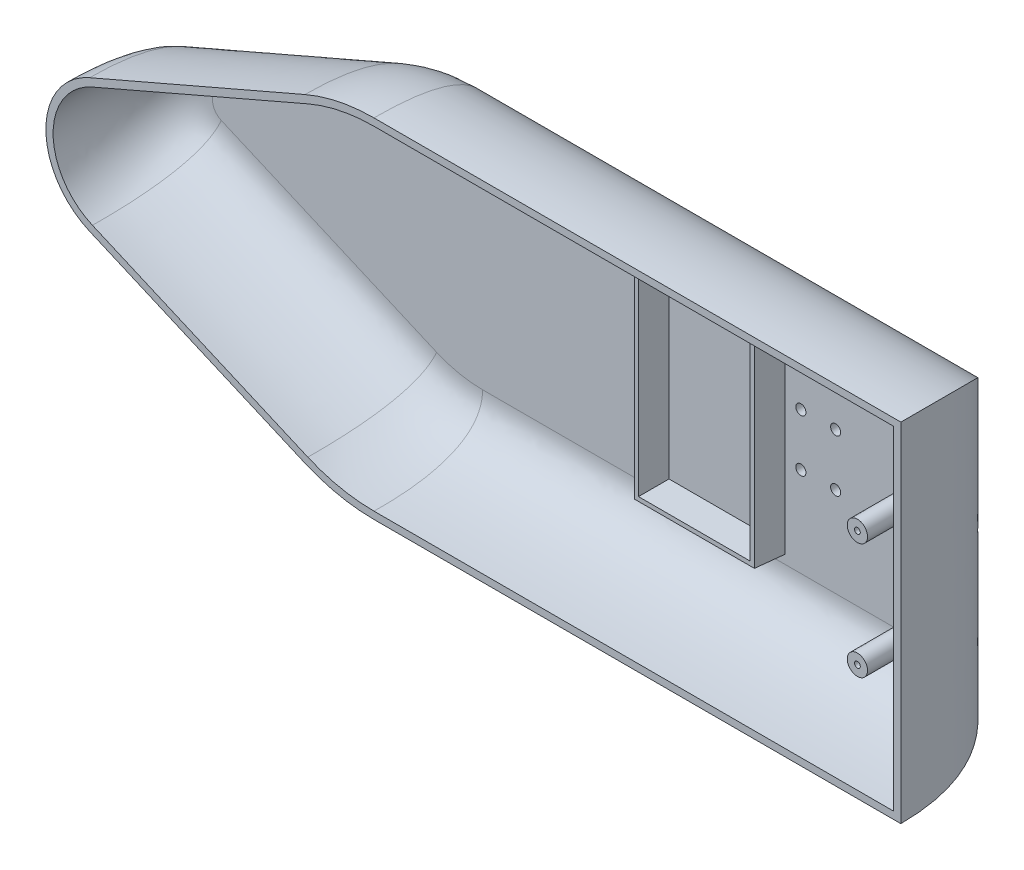
from build123d import *

# Parameters (mm, degrees)
BOSS_EXTRU_1_DEPTH           = 2.5
ENL_V_MAT_EXTRU_1_REACH      = 169.131
ESQUISSE3_R                  = 1.75
BOSS_EXTRU_2_DEPTH           = 10
BOSS_EXTRU_2_DRAFT           = -3
ESQUISSE4_W                  = 32.5
ESQUISSE4_H                  = 2.5
BOSS_EXTRU_2_PROFILE_2_DEPTH = 10
BOSS_EXTRU_2_PROFILE_2_DRAFT = -3
ENL_V_MAT_EXTRU_2_REACH      = 200.265
ESQUISSE8_R                  = 1
BOSS_EXTRU_3_REACH           = 200.265
ESQUISSE9_R                  = 3.5
ESQUISSE9_R_2                = 1


with BuildPart() as part:
    # Esquisse1 → Boss.-Extru.1 (new body)
    with BuildSketch(Plane.XY):
        with BuildLine():
            Line((149.100058284, 75.46875), (-12.711143092, 75.46875))
            ThreePointArc((-12.711143092, 75.46875), (-20.816828901, 74.638864342), (-28.58617509, 72.183642878))
            Line((-28.58617509, 72.183642878), (-102.884320715, 40.05811161))
            ThreePointArc((-102.884320715, 40.05811161), (-105.899941716, 35.46875), (-102.884320715, 30.87938839))
            Line((-102.884320715, 30.87938839), (-28.58617509, -1.246142878))
            ThreePointArc((-28.58617509, -1.246142878), (-20.816828901, -3.701364342), (-12.711143092, -4.53125))
            Line((-12.711143092, -4.53125), (149.100058284, -4.53125))
            Line((149.100058284, -4.53125), (149.100058284, 75.46875))
        make_face()
    extrude(amount=BOSS_EXTRU_1_DEPTH)

    # Esquisse3 → Enlèv. mat.-Extru.1 (cut, up to next)
    with BuildSketch(Plane.XY.offset(2.5), mode=Mode.PRIVATE) as enl_v_mat_extru_1_sk1:
        with Locations((97.100058284, 44.46875)):
            Circle(ESQUISSE3_R)
    enl_v_mat_extru_1_tool1 = extrude(enl_v_mat_extru_1_sk1.sketch, amount=-ENL_V_MAT_EXTRU_1_REACH, mode=Mode.PRIVATE) & part.part
    # Esquisse3 → Enlèv. mat.-Extru.1 (cut, up to next)
    with BuildSketch(Plane.XY.offset(2.5), mode=Mode.PRIVATE) as enl_v_mat_extru_1_sk2:
        with Locations((97.100058284, 26.46875)):
            Circle(ESQUISSE3_R)
    enl_v_mat_extru_1_tool2 = extrude(enl_v_mat_extru_1_sk2.sketch, amount=-ENL_V_MAT_EXTRU_1_REACH, mode=Mode.PRIVATE) & part.part
    # Esquisse3 → Enlèv. mat.-Extru.1 (cut, up to next)
    with BuildSketch(Plane.XY.offset(2.5), mode=Mode.PRIVATE) as enl_v_mat_extru_1_sk3:
        with Locations((109.100058284, 26.46875)):
            Circle(ESQUISSE3_R)
    enl_v_mat_extru_1_tool3 = extrude(enl_v_mat_extru_1_sk3.sketch, amount=-ENL_V_MAT_EXTRU_1_REACH, mode=Mode.PRIVATE) & part.part
    # Esquisse3 → Enlèv. mat.-Extru.1 (cut, up to next)
    with BuildSketch(Plane.XY.offset(2.5), mode=Mode.PRIVATE) as enl_v_mat_extru_1_sk4:
        with Locations((109.100058284, 44.46875)):
            Circle(ESQUISSE3_R)
    enl_v_mat_extru_1_tool4 = extrude(enl_v_mat_extru_1_sk4.sketch, amount=-ENL_V_MAT_EXTRU_1_REACH, mode=Mode.PRIVATE) & part.part
    add(enl_v_mat_extru_1_tool1.solids().sort_by_distance((97.100058, 44.46875, 2.5))[0], mode=Mode.SUBTRACT)
    add(enl_v_mat_extru_1_tool2.solids().sort_by_distance((97.100058, 26.46875, 2.5))[0], mode=Mode.SUBTRACT)
    add(enl_v_mat_extru_1_tool3.solids().sort_by_distance((109.100058, 26.46875, 2.5))[0], mode=Mode.SUBTRACT)
    add(enl_v_mat_extru_1_tool4.solids().sort_by_distance((109.100058, 44.46875, 2.5))[0], mode=Mode.SUBTRACT)


with BuildPart() as boss_extru_2_tool:
    # Esquisse4 → Boss.-Extru.2 (with draft: the straight prism first)
    with BuildSketch(Plane(origin=(0, 0, 2.5), x_dir=(-1, 0, 0), z_dir=(0, 0, -1))):
        Polygon((-51.600058284, 0.96875), (-89.100058284, 0.96875), (-89.100058284, 67.46875), (-91.600058284, 67.46875), (-91.600058284, -1.53125), (-49.100058284, -1.53125), (-49.100058284, 67.46875), (-51.600058284, 67.46875), align=None)
    extrude(amount=-BOSS_EXTRU_2_DEPTH)
    # Boss.-Extru.2: the draft: its side faces are tilted about the plane it starts from
    boss_extru_2_sides = [boss_extru_2_tool.faces().sort_by_distance(p)[0] for p in [
        (70.350058284, 0.96875, 7.5),
        (89.100058284, 34.21875, 7.5),
        (90.350058284, 67.46875, 7.5),
        (91.600058284, 32.96875, 7.5),
        (70.350058284, -1.53125, 7.5),
        (49.100058284, 32.96875, 7.5),
        (50.350058284, 67.46875, 7.5),
        (51.600058284, 34.21875, 7.5),
    ]]
    draft(boss_extru_2_sides, Plane(origin=(0, 0, 2.5), x_dir=(-1, 0, 0), z_dir=(0, 0, -1)), BOSS_EXTRU_2_DRAFT)


with BuildPart() as part_1:
    add(part.part)

    # Boss.-Extru.2: add boss_extru_2_tool
    add(boss_extru_2_tool.part)


with BuildPart() as boss_extru_2_profile_2_tool:
    # Esquisse4 → Boss.-Extru.2 profile 2 (with draft: the straight prism first)
    with BuildSketch(Plane(origin=(0, 0, 2.5), x_dir=(-1, 0, 0), z_dir=(0, 0, -1))):
        with Locations((-70.350058284, 71.21875)):
            Rectangle(ESQUISSE4_W, ESQUISSE4_H)
    extrude(amount=-BOSS_EXTRU_2_PROFILE_2_DEPTH)
    # Boss.-Extru.2 profile 2: the draft: its side faces are tilted about the plane it starts from
    boss_extru_2_profile_2_sides = [boss_extru_2_profile_2_tool.faces().sort_by_distance(p)[0] for p in [
        (54.100058284, 71.21875, 7.5),
        (70.350058284, 72.46875, 7.5),
        (86.600058284, 71.21875, 7.5),
        (70.350058284, 69.96875, 7.5),
    ]]
    draft(boss_extru_2_profile_2_sides, Plane(origin=(0, 0, 2.5), x_dir=(-1, 0, 0), z_dir=(0, 0, -1)), BOSS_EXTRU_2_PROFILE_2_DRAFT)


with BuildPart() as part_2:
    add(part_1.part)

    # Boss.-Extru.2 profile 2: add boss_extru_2_profile_2_tool
    add(boss_extru_2_profile_2_tool.part)

    # Balayage1: sweep along a path in Esquisse5
    with BuildLine(Plane.XY.offset(2.5)) as balayage1_path:
        Line((149.100058284, 75.46875), (-12.711143092, 75.46875))
        ThreePointArc((-12.711143092, 75.46875), (-20.816828901, 74.638864342), (-28.58617509, 72.183642878))
        Line((-28.58617509, 72.183642878), (-102.884320715, 40.05811161))
        ThreePointArc((-102.884320715, 40.05811161), (-105.899941716, 35.46875), (-102.884320715, 30.87938839))
        Line((-102.884320715, 30.87938839), (-28.58617509, -1.246142878))
        ThreePointArc((-28.58617509, -1.246142878), (-20.816828901, -3.701364342), (-12.711143092, -4.53125))
        Line((-12.711143092, -4.53125), (149.100058284, -4.53125))
        Line((149.100058284, -4.53125), (149.100058284, 75.46875))
    # Esquisse7 → Balayage1 (sweep)
    with BuildSketch(Plane(origin=(149.100058284, 0, 0), x_dir=(0, 0, -1), z_dir=(1, 0, 0))):
        with BuildLine():
            Line((-2.5, 75.46875), (0, 75.46875))
            add(Edge.make_bspline(
                [(0, 75.46875), (0, 86.411621691), (-9.099638508, 95.407035507), (-40, 95.46875)],
                knots=[0, 0, 0, 0, 1, 1, 1, 1], degree=3))
            Line((-40, 95.46875), (-40, 92.96875))
            add(Edge.make_bspline(
                [(-40, 92.96875), (-36.824934583, 92.96875), (-2.5, 94.513588254), (-2.5, 75.46875)],
                knots=[0, 0, 0, 0, 1, 1, 1, 1], degree=3))
        make_face()
    sweep(path=balayage1_path.line, transition=Transition.RIGHT)

    # Esquisse8 → Enlèv. mat.-Extru.2 (cut, up to next)
    with BuildSketch(Plane(origin=(0, 0, 0), x_dir=(-1, 0, 0), z_dir=(0, 0, -1)), mode=Mode.PRIVATE) as enl_v_mat_extru_2_sk1:
        with Locations((-154.100058284, 55.46875)):
            Circle(ESQUISSE8_R)
    enl_v_mat_extru_2_tool1 = extrude(enl_v_mat_extru_2_sk1.sketch, amount=-ENL_V_MAT_EXTRU_2_REACH, mode=Mode.PRIVATE) & part_2.part
    # Esquisse8 → Enlèv. mat.-Extru.2 (cut, up to next)
    with BuildSketch(Plane(origin=(0, 0, 0), x_dir=(-1, 0, 0), z_dir=(0, 0, -1)), mode=Mode.PRIVATE) as enl_v_mat_extru_2_sk2:
        with Locations((-154.100058284, 15.46875)):
            Circle(ESQUISSE8_R)
    enl_v_mat_extru_2_tool2 = extrude(enl_v_mat_extru_2_sk2.sketch, amount=-ENL_V_MAT_EXTRU_2_REACH, mode=Mode.PRIVATE) & part_2.part
    add(enl_v_mat_extru_2_tool1.solids().sort_by_distance((154.100058, 55.46875, 0))[0], mode=Mode.SUBTRACT)
    add(enl_v_mat_extru_2_tool2.solids().sort_by_distance((154.100058, 15.46875, 0))[0], mode=Mode.SUBTRACT)

    # Esquisse9 → Boss.-Extru.3 (add, up to next)
    with BuildSketch(Plane.XY.offset(40), mode=Mode.PRIVATE) as boss_extru_3_sk1:
        with Locations((154.100058284, 15.46875)):
            Circle(ESQUISSE9_R)
        with Locations(Location((154.100058284, 15.46875, 0), (0, 0, 180))):
            Circle(ESQUISSE9_R_2, mode=Mode.SUBTRACT)
    boss_extru_3_tool1 = extrude(boss_extru_3_sk1.sketch, amount=-BOSS_EXTRU_3_REACH, mode=Mode.PRIVATE) - part_2.part
    # Esquisse9 → Boss.-Extru.3 (add, up to next)
    with BuildSketch(Plane.XY.offset(40), mode=Mode.PRIVATE) as boss_extru_3_sk2:
        with Locations((154.100058284, 55.46875)):
            Circle(ESQUISSE9_R)
        with Locations(Location((154.100058284, 55.46875, 0), (0, 0, 180))):
            Circle(ESQUISSE9_R_2, mode=Mode.SUBTRACT)
    boss_extru_3_tool2 = extrude(boss_extru_3_sk2.sketch, amount=-BOSS_EXTRU_3_REACH, mode=Mode.PRIVATE) - part_2.part
    add(boss_extru_3_tool1.solids().sort_by_distance((150.699053, 15.46875, 40))[0])
    add(boss_extru_3_tool2.solids().sort_by_distance((150.699053, 55.46875, 40))[0])


solid = part_2.part
